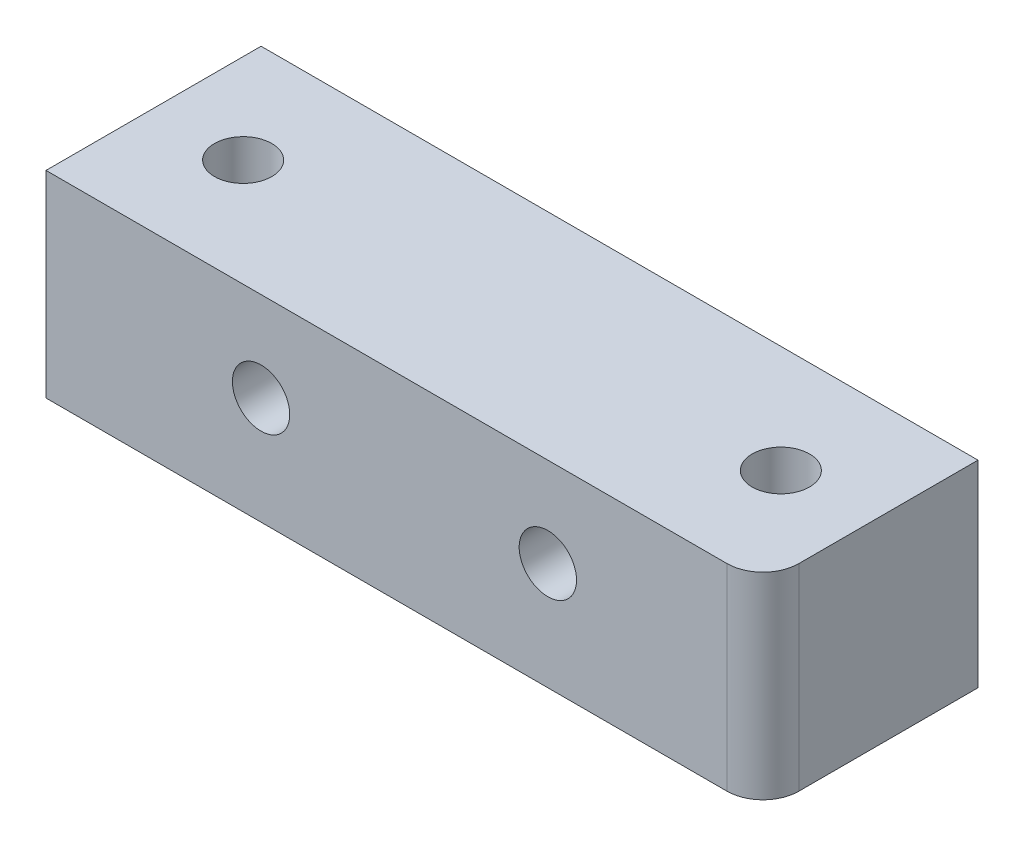
from build123d import *

# Parameters (mm, degrees)
SKETCH1_W             = 20
SKETCH1_H             = 6
BOSS_EXTRUDE1_DEPTH   = 5.5
M2X0_4_TAPPED_HOLE2_D = 1.6
FILLET1_R             = 1
M2X0_4_TAPPED_HOLE1_D = 1.6


with BuildPart() as part:
    # Sketch1 → Boss-Extrude1 (new body)
    with BuildSketch(Plane(origin=(0, 0, 0), x_dir=(1, 0, 0), z_dir=(0, 1, 0))):
        Rectangle(SKETCH1_W, SKETCH1_H)
    extrude(amount=-BOSS_EXTRUDE1_DEPTH)

    # M2x0.4 Tapped Hole2 (through all)
    with Locations(Plane(origin=(0, 0, 0), x_dir=(-1, 0, 0), z_dir=(0, 1, 0))):
        with Locations((7.5, 0), (-7.5, 0)):
            Hole(M2X0_4_TAPPED_HOLE2_D / 2)

    # Fillet1
    fillet1_edges = [part.edges().sort_by_distance(p)[0] for p in [
        (10, -2.75, 3),
    ]]
    fillet(fillet1_edges, radius=FILLET1_R)

    # M2x0.4 Tapped Hole1 (through all)
    with Locations(Plane.XY.offset(3)):
        with Locations((-4, -2.5), (4, -2.5)):
            Hole(M2X0_4_TAPPED_HOLE1_D / 2)


solid = part.part
